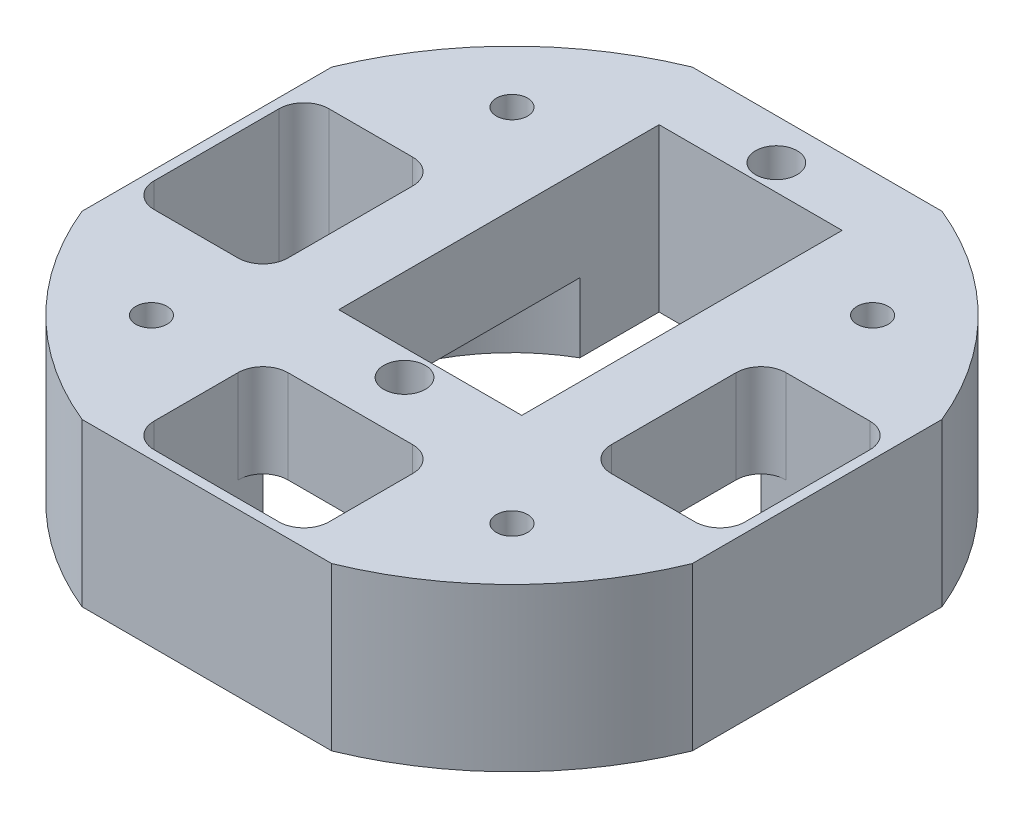
from build123d import *

# Parameters (mm, degrees)
SKETCH2_R           = 1.125
SKETCH2_R_2         = 1.5
SKETCH2_W           = 13.2
SKETCH2_H           = 23.1
BOSS_EXTRUDE3_DEPTH = 11.7
SKETCH2_9_R         = 1.5
CUT_EXTRUDE3_DEPTH  = 5
FILLET1_R           = 1.8


with BuildPart() as part:
    # Sketch2 → Boss-Extrude3 (new body)
    with BuildSketch(Plane(origin=(0, 0, 0), x_dir=(1, 0, 0), z_dir=(0, 1, 0))):
        with BuildLine():
            ThreePointArc((-9, 22), (-16.807736314, 16.807736314), (-22, 9))
            Line((-22, 9), (-22, -9))
            ThreePointArc((-22, -9), (-16.807736314, -16.807736314), (-9, -22))
            Line((-9, -22), (9, -22))
            ThreePointArc((9, -22), (16.807736314, -16.807736314), (22, -9))
            Line((22, -9), (22, 9))
            ThreePointArc((22, 9), (16.807736314, 16.807736314), (9, 22))
            Line((9, 22), (-9, 22))
        make_face()
        with Locations(Location((-13, -13, 0), (0, 0, 270))):
            Circle(SKETCH2_R, mode=Mode.SUBTRACT)
        with BuildLine():
            Line((6.3, -11.65643599), (6.3, -19.5))
            ThreePointArc((6.3, -19.5), (5.772792206, -20.772792206), (4.5, -21.3))
            Line((4.5, -21.3), (-4.5, -21.3))
            ThreePointArc((-4.5, -21.3), (-5.772792206, -20.772792206), (-6.3, -19.5))
            Line((-6.3, -19.5), (-6.3, -11.65643599))
            Line((-6.3, -11.65643599), (6.3, -11.65643599))
        make_face(mode=Mode.SUBTRACT)
        with Locations(Location((13, -13, 0), (0, 0, 270))):
            Circle(SKETCH2_R, mode=Mode.SUBTRACT)
        with Locations(Location((0, -7.75, 0), (0, 0, 270))):
            Circle(SKETCH2_R_2, mode=Mode.SUBTRACT)
        with BuildLine():
            Line((-19.5, 6.3), (-11.65643599, 6.3))
            Line((-11.65643599, 6.3), (-11.65643599, -6.3))
            Line((-11.65643599, -6.3), (-19.5, -6.3))
            ThreePointArc((-19.5, -6.3), (-20.772792206, -5.772792206), (-21.3, -4.5))
            Line((-21.3, -4.5), (-21.3, 4.5))
            ThreePointArc((-21.3, 4.5), (-20.772792206, 5.772792206), (-19.5, 6.3))
        make_face(mode=Mode.SUBTRACT)
        with Locations(Location((0, 19.06, 0), (0, 0, 270))):
            Circle(SKETCH2_R_2, mode=Mode.SUBTRACT)
        with Locations((0, 5.655)):
            Rectangle(SKETCH2_W, SKETCH2_H, mode=Mode.SUBTRACT)
        with BuildLine():
            Line((11.65643599, 6.3), (19.5, 6.3))
            ThreePointArc((19.5, 6.3), (20.772792206, 5.772792206), (21.3, 4.5))
            Line((21.3, 4.5), (21.3, -4.5))
            ThreePointArc((21.3, -4.5), (20.772792206, -5.772792206), (19.5, -6.3))
            Line((19.5, -6.3), (11.65643599, -6.3))
            Line((11.65643599, -6.3), (11.65643599, 6.3))
        make_face(mode=Mode.SUBTRACT)
        with Locations(Location((13, 13, 0), (0, 0, 270))):
            Circle(SKETCH2_R, mode=Mode.SUBTRACT)
        with Locations(Location((-13, 13, 0), (0, 0, 270))):
            Circle(SKETCH2_R, mode=Mode.SUBTRACT)
    extrude(amount=BOSS_EXTRUDE3_DEPTH)

    # Sketch2<9> → Cut-Extrude3 (cut)
    with BuildSketch(Plane(origin=(0, 0, 0), x_dir=(1, 0, 0), z_dir=(0, 1, 0))):
        with BuildLine():
            Line((-6.3, -11.65643599), (6.3, -11.65643599))
            ThreePointArc((6.3, -11.65643599), (9.369164851, -9.369164851), (11.65643599, -6.3))
            Line((11.65643599, -6.3), (11.65643599, 6.3))
            ThreePointArc((11.65643599, 6.3), (9.489805129, 9.246950774), (6.6, 11.489234091))
            Line((6.6, 11.489234091), (6.6, -5.895))
            Line((6.6, -5.895), (-6.6, -5.895))
            Line((-6.6, -5.895), (-6.6, 11.489234091))
            ThreePointArc((-6.6, 11.489234091), (-9.489805129, 9.246950774), (-11.65643599, 6.3))
            Line((-11.65643599, 6.3), (-11.65643599, -6.3))
            ThreePointArc((-11.65643599, -6.3), (-9.369164851, -9.369164851), (-6.3, -11.65643599))
        make_face()
        with Locations(Location((0, -7.75, 0), (0, 0, 270))):
            Circle(SKETCH2_9_R, mode=Mode.SUBTRACT)
    extrude(amount=CUT_EXTRUDE3_DEPTH, mode=Mode.SUBTRACT)

    # Fillet1
    fillet1_edges = [part.edges().sort_by_distance(p)[0] for p in [
        (-11.65643599, 8.35, 6.3),
        (-11.65643599, 8.35, -6.3),
        (6.3, 8.35, 11.65643599),
        (-6.3, 8.35, 11.65643599),
        (11.65643599, 8.35, -6.3),
        (11.65643599, 8.35, 6.3),
    ]]
    fillet(fillet1_edges, radius=FILLET1_R)


solid = part.part
